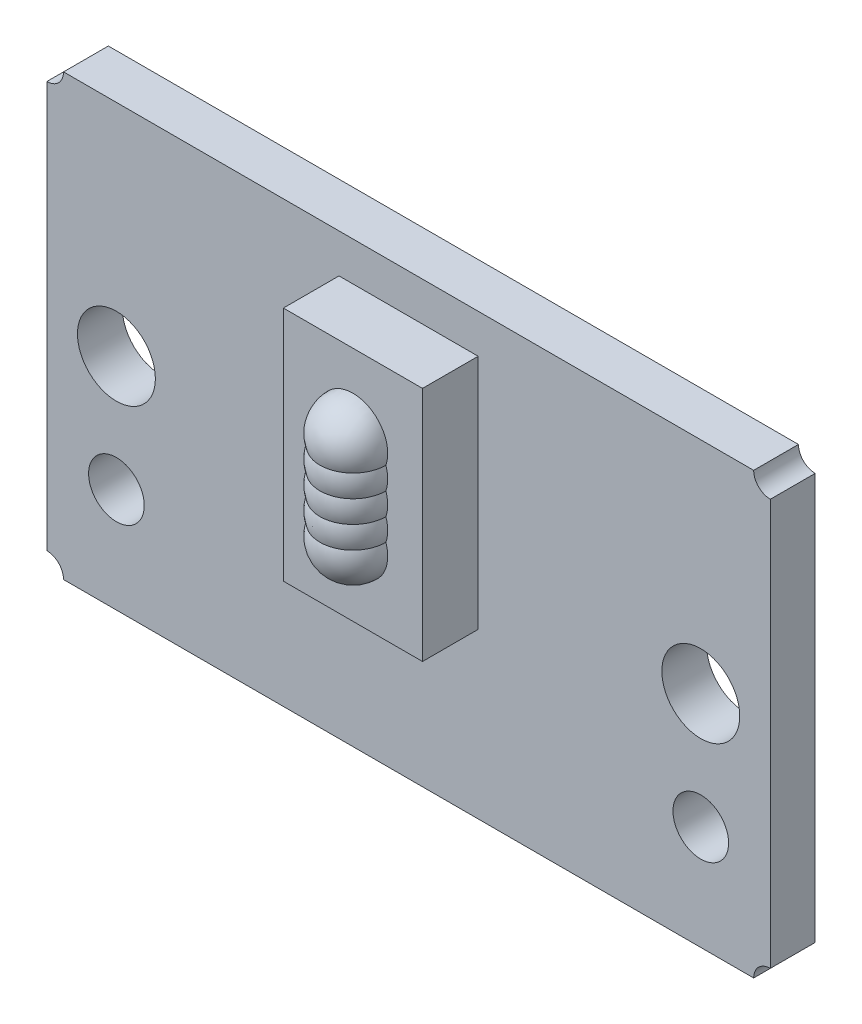
from build123d import *

# Parameters (mm, degrees)
SKETCH1_W           = 26
SKETCH1_H           = 15.8
BOSS_EXTRUDE1_DEPTH = 1.61
SKETCH2_R           = 0.6
CUT_EXTRUDE1_DEPTH  = 1.61
SKETCH3_R           = 1.4
SKETCH3_R_2         = 1
CUT_EXTRUDE2_DEPTH  = 11.61
SKETCH4_W           = 5
SKETCH4_H           = 8.5
BOSS_EXTRUDE2_DEPTH = 2
LPATTERN1_COUNT     = 3
LPATTERN1_PITCH     = 0.8
LPATTERN1_COL_COUNT = 3
LPATTERN1_COL_PITCH = 0.8


with BuildPart() as part:
    # Sketch1 → Boss-Extrude1 (new body)
    with BuildSketch(Plane.XY):
        Rectangle(SKETCH1_W, SKETCH1_H)
    extrude(amount=BOSS_EXTRUDE1_DEPTH)

    # Sketch2 → Cut-Extrude1 (cut)
    with BuildSketch(Plane.XY.offset(1.61)):
        with Locations((-13, 7.9)):
            Circle(SKETCH2_R)
        with Locations((-13, -7.9)):
            Circle(SKETCH2_R)
        with Locations((13, -7.9)):
            Circle(SKETCH2_R)
        with Locations((13, 7.9)):
            Circle(SKETCH2_R)
    extrude(amount=-CUT_EXTRUDE1_DEPTH, mode=Mode.SUBTRACT)

    # Sketch3 → Cut-Extrude2 (cut)
    with BuildSketch(Plane.XY.offset(1.61)):
        with Locations((-10.5, 0)):
            Circle(SKETCH3_R)
        with Locations((10.5, 0)):
            Circle(SKETCH3_R)
        with Locations((-10.5, -4.15)):
            Circle(SKETCH3_R_2)
        with Locations((10.5, -4.15)):
            Circle(SKETCH3_R_2)
    extrude(amount=-CUT_EXTRUDE2_DEPTH, mode=Mode.SUBTRACT)

    # Sketch4 → Boss-Extrude2 (add)
    with BuildSketch(Plane.XY.offset(1.61)):
        with Locations((0, 2.25)):
            Rectangle(SKETCH4_W, SKETCH4_H)
    extrude(amount=BOSS_EXTRUDE2_DEPTH)

    # Sketch5 → Revolve1 (revolve)
    with BuildSketch(Plane.XY.offset(3.61)):
        with BuildLine():
            Line((1.25, 2.25), (-1.25, 2.25))
            ThreePointArc((-1.25, 2.25), (0, 3.5), (1.25, 2.25))
        make_face()
    revolve1 = revolve(axis=Axis((1.25, 2.25, 3.61), (-1, 0, 0)))

    # LPattern1: Revolve1 ×3
    with Locations(*[(0, -i * LPATTERN1_PITCH, 0) for i in range(1, LPATTERN1_COUNT)]):
        add(revolve1)

    # LPattern1 col: Revolve1 ×3
    with Locations(*[(0, i * LPATTERN1_COL_PITCH, 0) for i in range(1, LPATTERN1_COL_COUNT)]):
        add(revolve1)


solid = part.part
